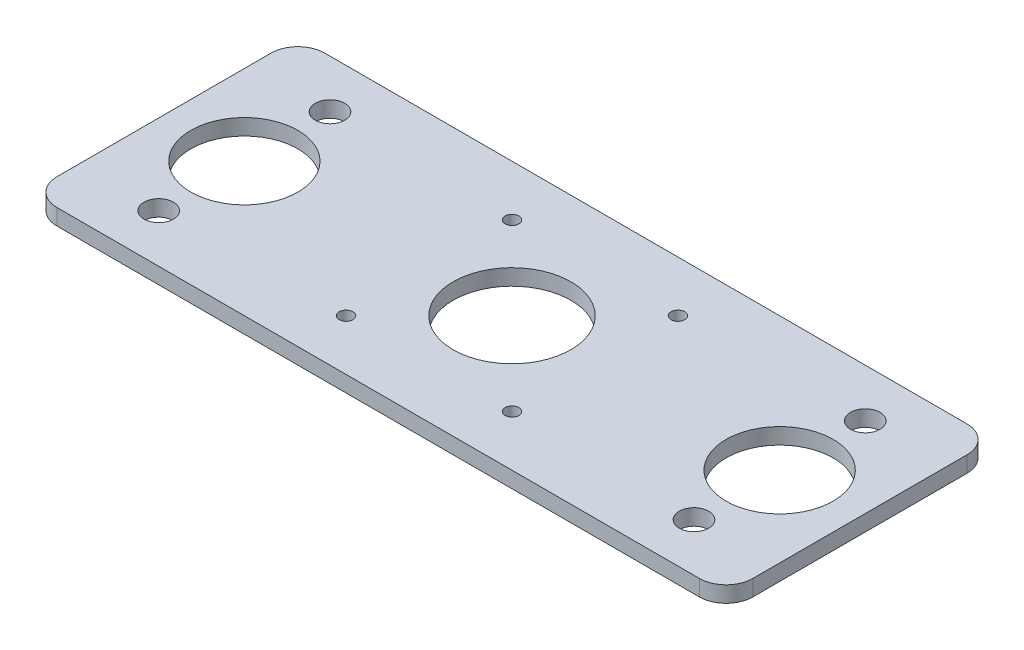
from build123d import *

# Parameters (mm, degrees)
SKETCH_1_R      = 2.75
SKETCH_1_R_2    = 11
SKETCH_1_R_3    = 1.283558174
SKETCH_1_R_4    = 10
EXTRUDE_1_DEPTH = 3


with BuildPart() as part:
    # 草图1 → 凸台-拉伸1 (new body)
    with BuildSketch(Plane(origin=(0, 0, 0), x_dir=(1, 0, 0), z_dir=(0, 1, 0))):
        with BuildLine():
            ThreePointArc((-65, 20), (-63.535533906, 23.535533906), (-60, 25))
            Line((-60, 25), (0, 25))
            Line((0, 25), (60, 25))
            ThreePointArc((60, 25), (63.535533906, 23.535533906), (65, 20))
            Line((65, 20), (65, -20))
            ThreePointArc((65, -20), (63.535533906, -23.535533906), (60, -25))
            Line((60, -25), (-60, -25))
            ThreePointArc((-60, -25), (-63.535533906, -23.535533906), (-65, -20))
            Line((-65, -20), (-65, 20))
        make_face()
        with Locations(Location((-50, 16, 0), (0, 0, 270))):
            Circle(SKETCH_1_R, mode=Mode.SUBTRACT)
        with Locations(Location((0, 0, 0), (0, 0, 270))):
            Circle(SKETCH_1_R_2, mode=Mode.SUBTRACT)
        with Locations(Location((15.5, 15.5, 0), (0, 0, 270))):
            Circle(SKETCH_1_R_3, mode=Mode.SUBTRACT)
        with Locations(Location((15.5, -15.5, 0), (0, 0, 270))):
            Circle(SKETCH_1_R_3, mode=Mode.SUBTRACT)
        with Locations(Location((-15.5, -15.5, 0), (0, 0, 270))):
            Circle(SKETCH_1_R_3, mode=Mode.SUBTRACT)
        with Locations(Location((-15.5, 15.5, 0), (0, 0, 270))):
            Circle(SKETCH_1_R_3, mode=Mode.SUBTRACT)
        with Locations(Location((50, 0, 0), (0, 0, 270))):
            Circle(SKETCH_1_R_4, mode=Mode.SUBTRACT)
        with Locations(Location((50, 16, 0), (0, 0, 270))):
            Circle(SKETCH_1_R, mode=Mode.SUBTRACT)
        with Locations(Location((50, -16, 0), (0, 0, 270))):
            Circle(SKETCH_1_R, mode=Mode.SUBTRACT)
        with Locations(Location((-50, -16, 0), (0, 0, 270))):
            Circle(SKETCH_1_R, mode=Mode.SUBTRACT)
        with Locations(Location((-50, 0, 0), (0, 0, 270))):
            Circle(SKETCH_1_R_4, mode=Mode.SUBTRACT)
    extrude(amount=EXTRUDE_1_DEPTH)


solid = part.part
